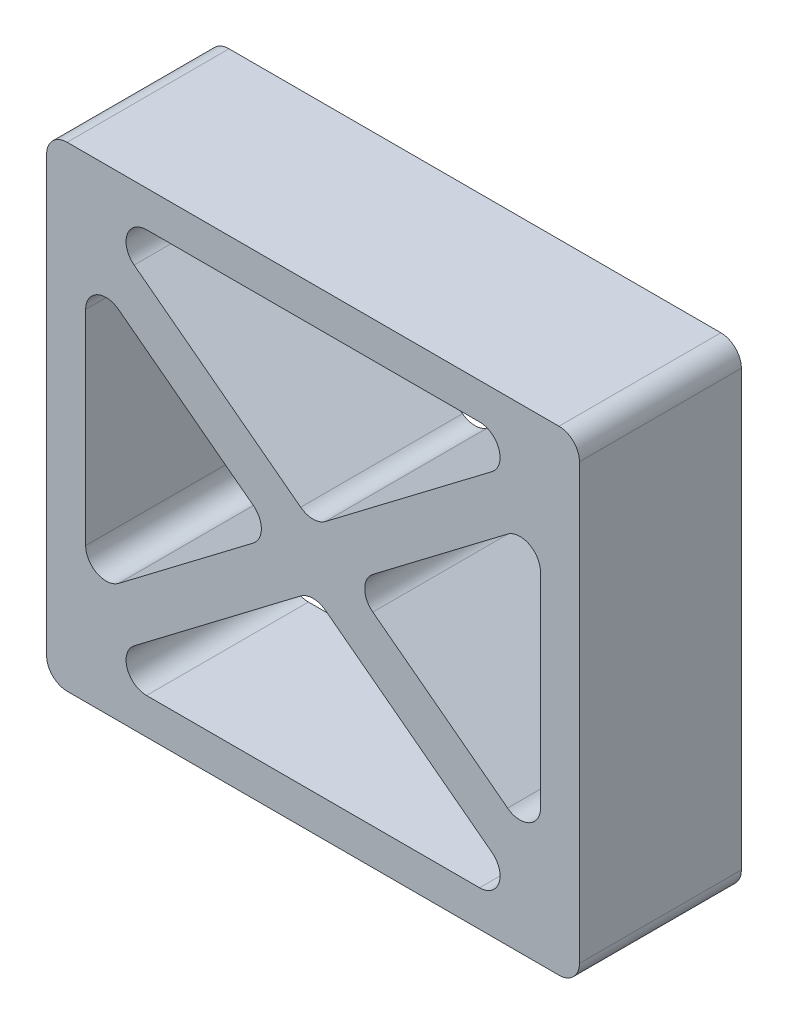
from build123d import *

# Parameters (mm, degrees)
CROQUIS1_W              = 130
CROQUIS1_H              = 116
SALIENTE_EXTRUIR1_DEPTH = 39.5
CORTAR_EXTRUIR1_DEPTH   = 39.5
REDONDEO1_R             = 5


with BuildPart() as part:
    # Croquis1 → Saliente-Extruir1 (new body)
    with BuildSketch(Plane.XY):
        with Locations((10.583554643, -12.877675841)):
            Rectangle(CROQUIS1_W, CROQUIS1_H)
    extrude(amount=SALIENTE_EXTRUIR1_DEPTH)

    # Croquis2 → Cortar-Extruir1 (cut)
    with BuildSketch(Plane.XY.offset(39.5)):
        Polygon((-44.901782094, 36.331293299), (66.068891381, 36.331293299), (10.583554643, -5.790794085), align=None)
        Polygon((-44.901782094, 22.157529787), (-44.901782094, -47.912881469), (1.248356768, -12.877675841), align=None)
        Polygon((19.918752519, -12.877675841), (66.068891381, 22.157529787), (66.068891381, -47.912881469), align=None)
        Polygon((-44.901782094, -62.086644981), (10.583554643, -19.964557597), (66.068891381, -62.086644981), align=None)
    extrude(amount=-CORTAR_EXTRUIR1_DEPTH, mode=Mode.SUBTRACT)

    # Redondeo1
    redondeo1_edges = [part.edges().sort_by_distance(p)[0] for p in [
        (10.583554643, -5.790794085, 19.75),
        (-44.901782094, 36.331293299, 19.75),
        (66.068891381, 36.331293299, 19.75),
        (-44.901782094, 22.157529787, 19.75),
        (1.248356768, -12.877675841, 19.75),
        (-44.901782094, -47.912881469, 19.75),
        (66.068891381, -47.912881469, 19.75),
        (19.918752519, -12.877675841, 19.75),
        (66.068891381, 22.157529787, 19.75),
        (66.068891381, -62.086644981, 19.75),
        (-44.901782094, -62.086644981, 19.75),
        (10.583554643, -19.964557597, 19.75),
        (-54.416445357, 45.122324159, 19.75),
        (75.583554643, 45.122324159, 19.75),
        (75.583554643, -70.877675841, 19.75),
        (-54.416445357, -70.877675841, 19.75),
    ]]
    fillet(redondeo1_edges, radius=REDONDEO1_R)


solid = part.part
